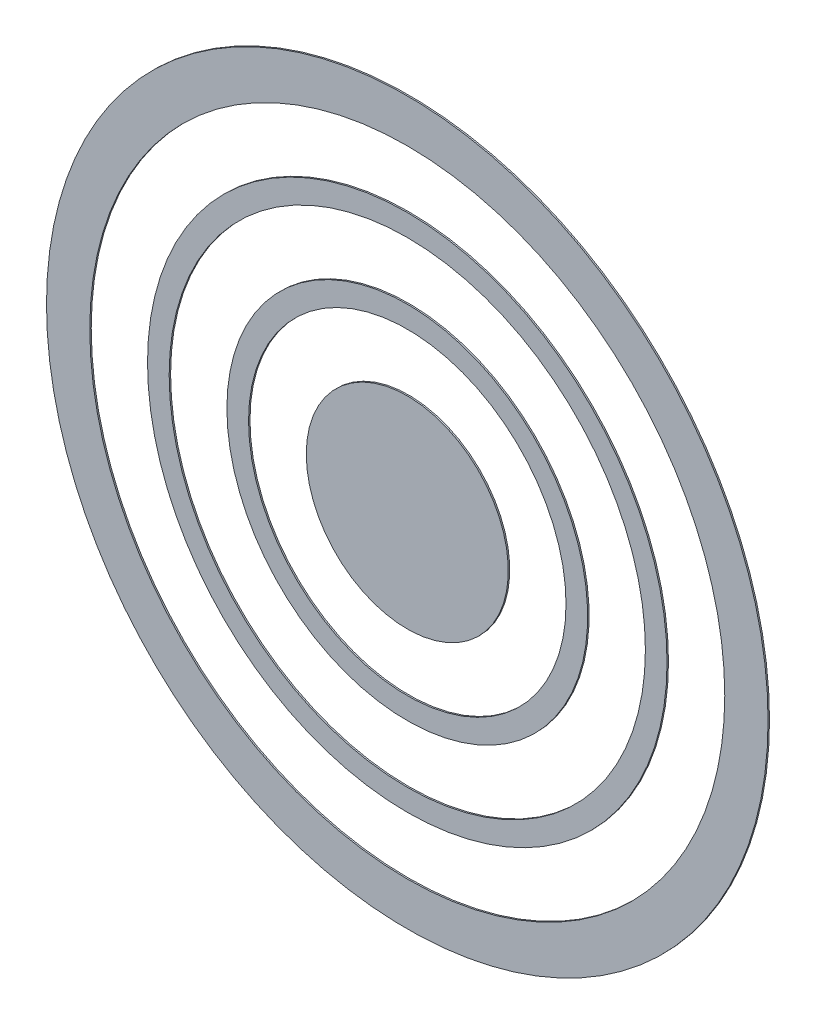
from build123d import *

# Parameters (mm, degrees)
SKETCH_1_R        = 2.5
SKETCH_1_R_2      = 2.2
EXTRUDE_1_DEPTH   = 0.01
SKETCH_1_R_3      = 1.8
SKETCH_1_R_4      = 1.65
EXTRUDE_1_2_DEPTH = 0.01
SKETCH_1_R_5      = 1.25
SKETCH_1_R_6      = 1.1
EXTRUDE_1_3_DEPTH = 0.01
SKETCH_1_R_7      = 0.7
EXTRUDE_1_4_DEPTH = 0.01


with BuildPart() as part:
    # Эскиз1 → Бобышка-Вытянуть1 (new body)
    with BuildSketch(Plane.XY):
        with Locations(Location((0, 0, 0), (0, 0, 180))):
            Circle(SKETCH_1_R)
        with Locations(Location((0, 0, 0), (0, 0, 180))):
            Circle(SKETCH_1_R_2, mode=Mode.SUBTRACT)
    extrude(amount=EXTRUDE_1_DEPTH)


with BuildPart() as body_2:
    # Эскиз1 → Extrude 1 2 (new body)
    with BuildSketch(Plane.XY):
        with Locations(Location((0, 0, 0), (0, 0, 180))):
            Circle(SKETCH_1_R_3)
        with Locations(Location((0, 0, 0), (0, 0, 180))):
            Circle(SKETCH_1_R_4, mode=Mode.SUBTRACT)
    extrude(amount=EXTRUDE_1_2_DEPTH)


with BuildPart() as body_3:
    # Эскиз1 → Extrude 1 3 (new body)
    with BuildSketch(Plane.XY):
        with Locations(Location((0, 0, 0), (0, 0, 180))):
            Circle(SKETCH_1_R_5)
        with Locations(Location((0, 0, 0), (0, 0, 180))):
            Circle(SKETCH_1_R_6, mode=Mode.SUBTRACT)
    extrude(amount=EXTRUDE_1_3_DEPTH)


with BuildPart() as body_4:
    # Эскиз1 → Extrude 1 4 (new body)
    with BuildSketch(Plane.XY):
        with Locations(Location((0, 0, 0), (0, 0, 180))):
            Circle(SKETCH_1_R_7)
    extrude(amount=EXTRUDE_1_4_DEPTH)


solid = Compound([part.part, body_2.part, body_3.part, body_4.part])
